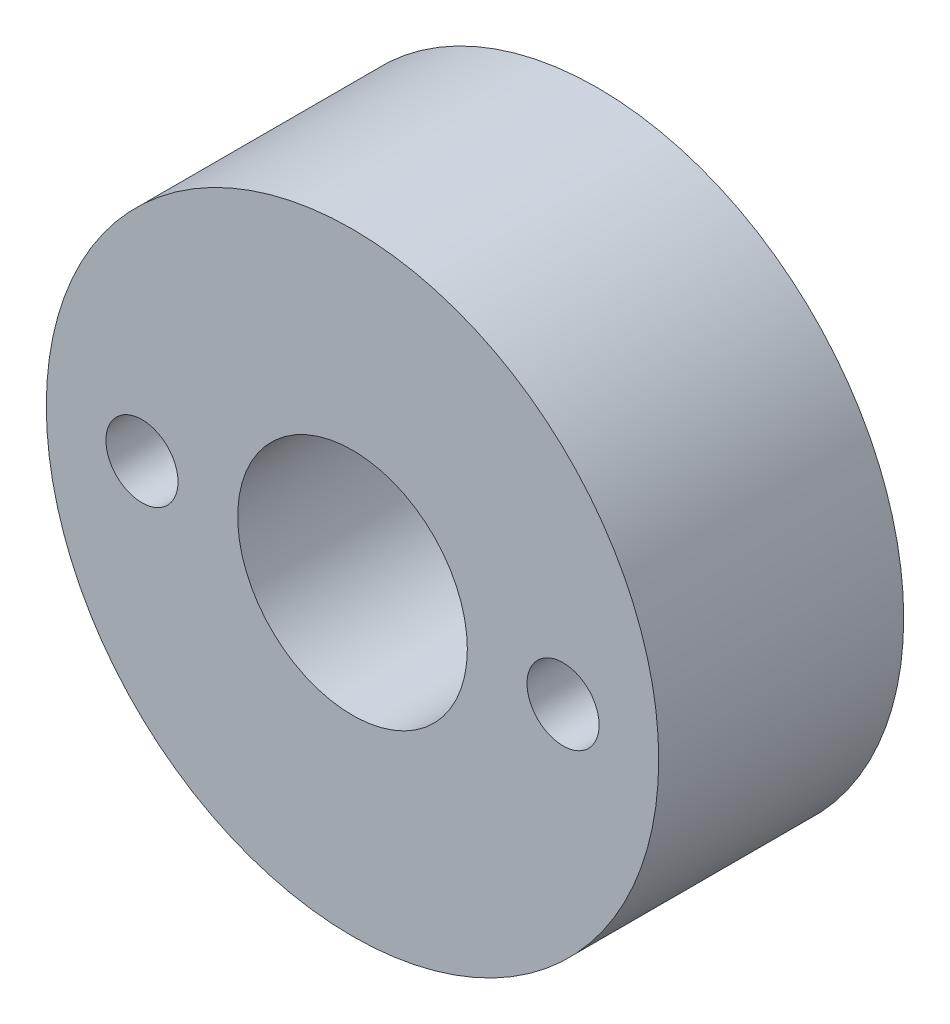
from build123d import *

# Parameters (mm, degrees)
SKETCH1_R           = 12.7
SKETCH1_R_2         = 4.7625
BOSS_EXTRUDE1_DEPTH = 5.08
SKETCH2_R           = 1.49479
CUT_EXTRUDE1_DEPTH  = 10.16


with BuildPart() as part:
    # Sketch1 → Boss-Extrude1 (new, symmetric)
    with BuildSketch(Plane.XY):
        Circle(SKETCH1_R)
        Circle(SKETCH1_R_2, mode=Mode.SUBTRACT)
    extrude(amount=BOSS_EXTRUDE1_DEPTH, both=True)

    # Sketch2 → Cut-Extrude1 (cut)
    with BuildSketch(Plane.XY.offset(5.08)):
        with Locations((8.73252, 0)):
            Circle(SKETCH2_R)
        with Locations((-8.73252, 0)):
            Circle(SKETCH2_R)
    extrude(amount=-CUT_EXTRUDE1_DEPTH, mode=Mode.SUBTRACT)


solid = part.part
